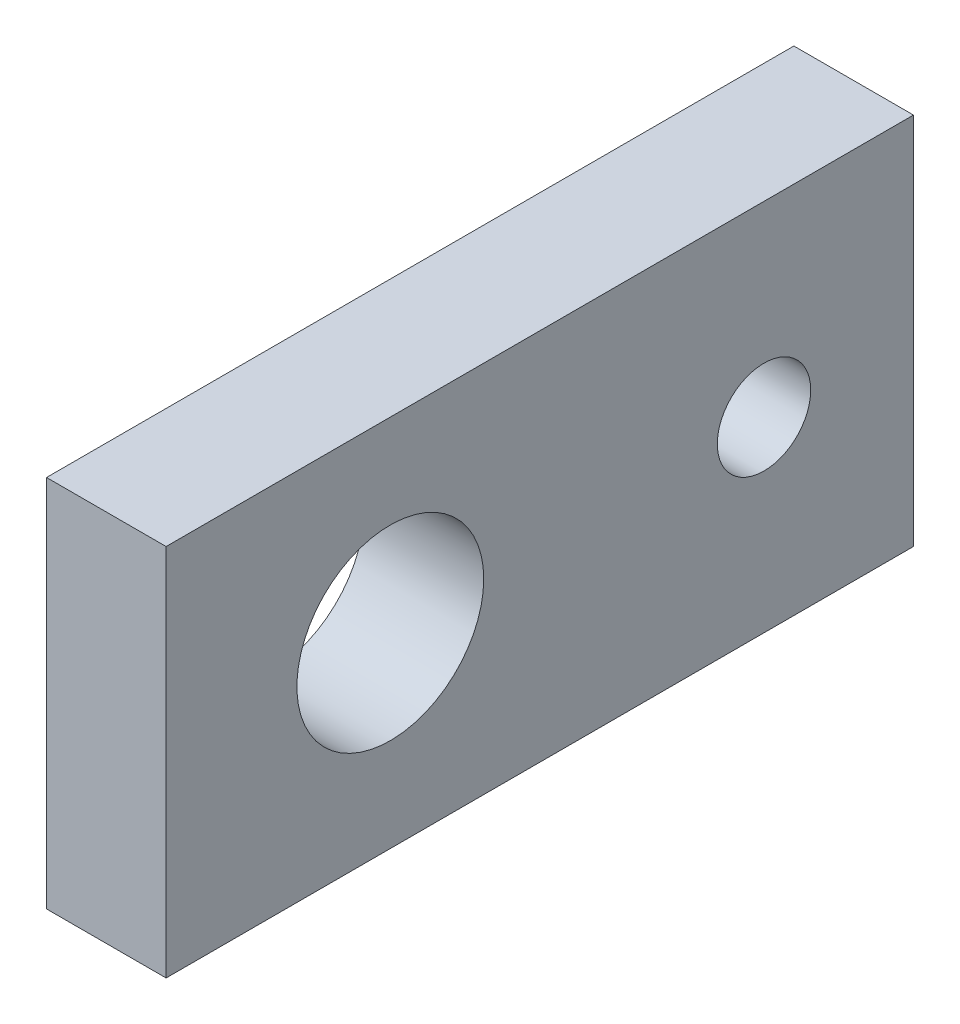
from build123d import *

# Parameters (mm, degrees)
SKETCH1_W                          = 12.7
SKETCH1_H                          = 6.35
BOSS_EXTRUDE1_DEPTH                = 2.032
F_1_16_0_0625_DIAMETER_HOLE1_D     = 1.5875
F_1_16_0_0625_DIAMETER_HOLE1_DEPTH = 70.104
F_1_16_0_0625_DIAMETER_HOLE1_TIP   = 0.476933116
F_1_8_0_125_DIAMETER_HOLE1_D       = 3.175
F_1_8_0_125_DIAMETER_HOLE1_DEPTH   = 70.104
F_1_8_0_125_DIAMETER_HOLE1_TIP     = 0.953866233


with BuildPart() as part:
    # Sketch1 → Boss-Extrude1 (new body)
    with BuildSketch(Plane(origin=(0, 0, 0), x_dir=(0, 0, -1), z_dir=(1, 0, 0))):
        with Locations((6.35, 3.175)):
            Rectangle(SKETCH1_W, SKETCH1_H)
    extrude(amount=BOSS_EXTRUDE1_DEPTH)

    # 1/16 (0.0625) Diameter Hole1
    with Locations(Plane(origin=(2.032, 0, 0), x_dir=(0, 0, -1), z_dir=(1, 0, 0))):
        with Locations((10.16, 3.175)):
            Hole(F_1_16_0_0625_DIAMETER_HOLE1_D / 2, depth=F_1_16_0_0625_DIAMETER_HOLE1_DEPTH)
            with Locations((0, 0, -(F_1_16_0_0625_DIAMETER_HOLE1_DEPTH + F_1_16_0_0625_DIAMETER_HOLE1_TIP / 2))):  # 118° drill point
                Cone(0, F_1_16_0_0625_DIAMETER_HOLE1_D / 2, F_1_16_0_0625_DIAMETER_HOLE1_TIP, mode=Mode.SUBTRACT)

    # 1/8 (0.125) Diameter Hole1
    with Locations(Plane(origin=(2.032, 0, 0), x_dir=(0, 0, -1), z_dir=(1, 0, 0))):
        with Locations((3.81, 3.175)):
            Hole(F_1_8_0_125_DIAMETER_HOLE1_D / 2, depth=F_1_8_0_125_DIAMETER_HOLE1_DEPTH)
            with Locations((0, 0, -(F_1_8_0_125_DIAMETER_HOLE1_DEPTH + F_1_8_0_125_DIAMETER_HOLE1_TIP / 2))):  # 118° drill point
                Cone(0, F_1_8_0_125_DIAMETER_HOLE1_D / 2, F_1_8_0_125_DIAMETER_HOLE1_TIP, mode=Mode.SUBTRACT)


solid = part.part
